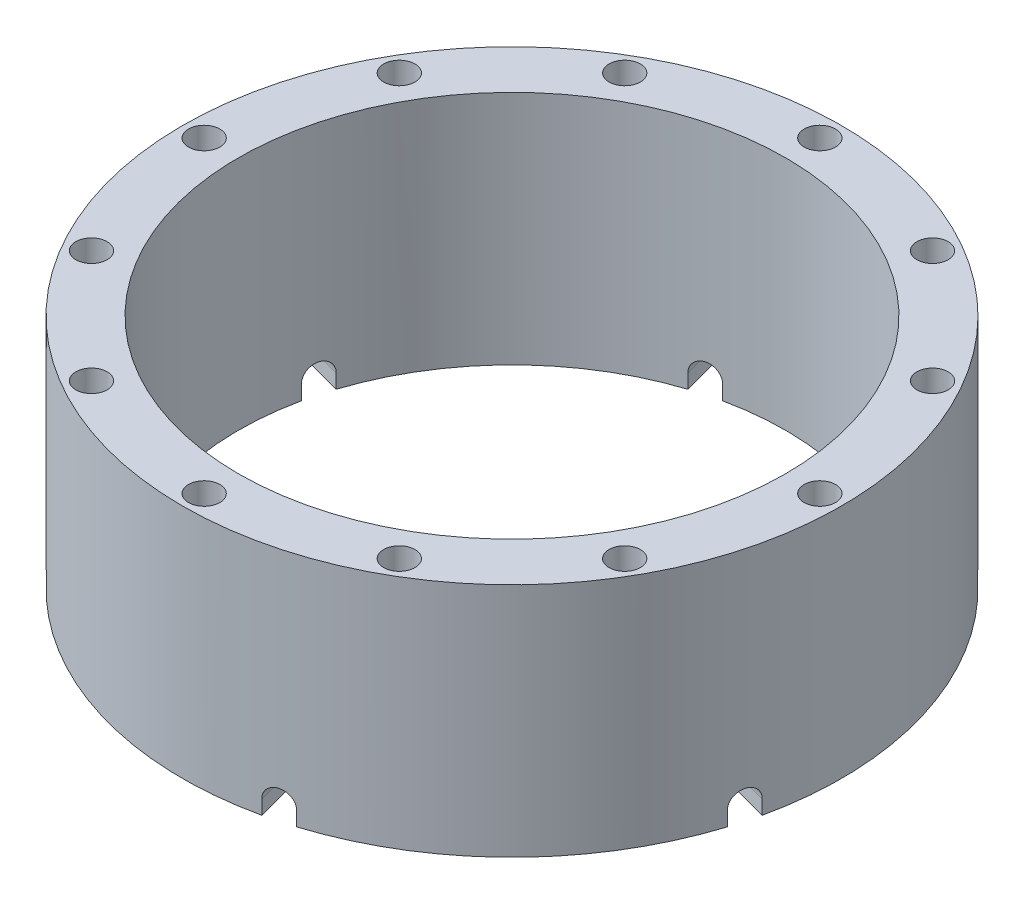
from build123d import *

# Parameters (mm, degrees)
SKETCH_1_R               = 57.8
SKETCH_1_R_2             = 48
EXTRUDE_1_DEPTH          = 41.4
SKETCH_2_R               = 2.75
CUT_EXTRUDE_1_DEPTH      = 92.627725062
PATTERN_CIRCULAR_1_COUNT = 12
SKETCH_3_R               = 2.5
CUT_EXTRUDE_2_DEPTH      = 92.627725062
PATTERN_CIRCULAR_2_COUNT = 6


with BuildPart() as part:
    # 草图1 → 凸台-拉伸1 (new body)
    with BuildSketch(Plane(origin=(0, 0, 0), x_dir=(1, 0, 0), z_dir=(0, 1, 0))):
        with Locations(Location((0, 0, 0), (0, 0, 270))):
            Circle(SKETCH_1_R)
        with Locations(Location((0, 0, 0), (0, 0, 270))):
            Circle(SKETCH_1_R_2, mode=Mode.SUBTRACT)
    extrude(amount=EXTRUDE_1_DEPTH)

    # 草图2 → 切除-拉伸1 (cut, symmetric)
    with BuildSketch(Plane(origin=(0, 41.4, 0), x_dir=(1, 0, 0), z_dir=(0, 1, 0))):
        with Locations(Location((0, 54, 0), (0, 0, 270))):
            Circle(SKETCH_2_R)
    cut_extrude_1 = extrude(amount=CUT_EXTRUDE_1_DEPTH, both=True, mode=Mode.SUBTRACT)

    # 阵列(圆周)1: 切除-拉伸1 ×12 about axis
    pattern_circular_1_axis = Axis((0, 0, 0), (0, 1, 0))
    for i in range(1, PATTERN_CIRCULAR_1_COUNT):
        add(cut_extrude_1.rotate(pattern_circular_1_axis, i * 360 / PATTERN_CIRCULAR_1_COUNT), mode=Mode.SUBTRACT)

    # 草图3 → 切除-拉伸2 (cut, through all)
    with BuildSketch(Plane(origin=(0, 0, 0), x_dir=(0.7071067811865477, 0, 0.7071067811865475), z_dir=(-0.7071067811865475, 0, 0.7071067811865477))):
        with Locations((0, 2.5)):
            Circle(SKETCH_3_R)
        with BuildLine():
            Line((2.5, 0), (2.5, 2.5))
            ThreePointArc((2.5, 2.5), (1.767766953, 0.732233047), (0, 0))
            Line((0, 0), (2.5, 0))
        make_face()
        with BuildLine():
            ThreePointArc((0, 0), (-1.767766953, 0.732233047), (-2.5, 2.5))
            Line((-2.5, 2.5), (-2.5, 0))
            Line((-2.5, 0), (0, 0))
        make_face()
    cut_extrude_2 = extrude(amount=-CUT_EXTRUDE_2_DEPTH, mode=Mode.SUBTRACT)

    # 阵列(圆周)2: 切除-拉伸2 ×6 about axis
    pattern_circular_2_axis = Axis((0, 0, 0), (0, 1, 0))
    for i in range(1, PATTERN_CIRCULAR_2_COUNT):
        add(cut_extrude_2.rotate(pattern_circular_2_axis, i * 360 / PATTERN_CIRCULAR_2_COUNT), mode=Mode.SUBTRACT)


solid = part.part
